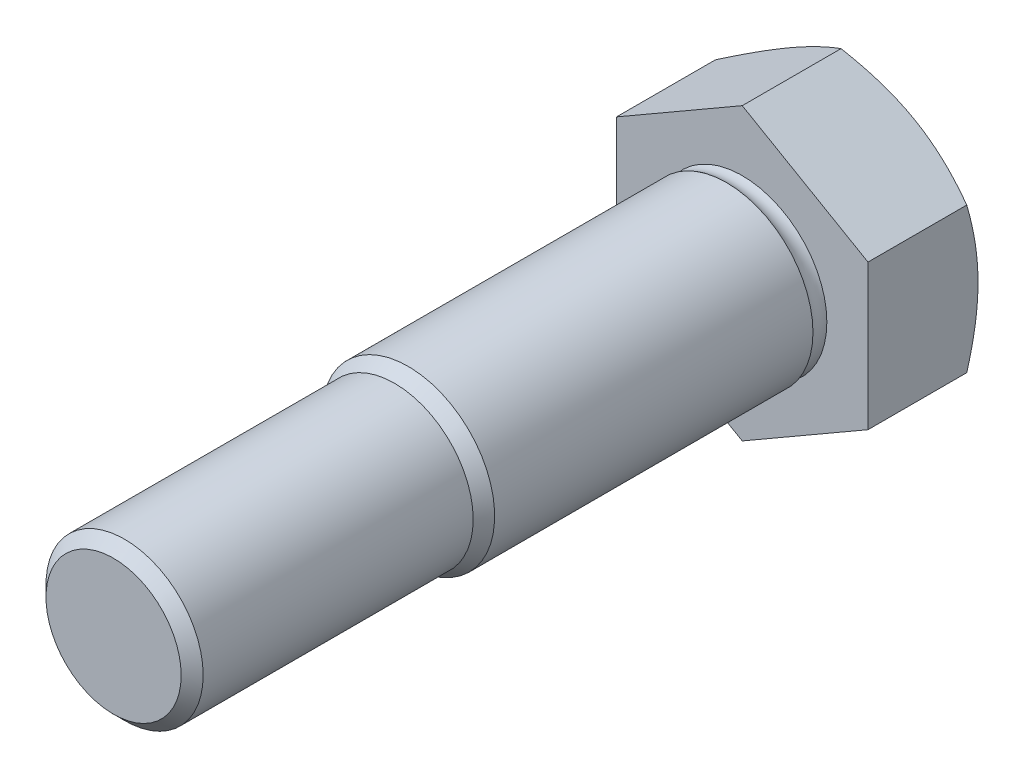
from build123d import *

# Parameters (mm, degrees)
VYSUNOUT1_DEPTH = 7
SKICA5_R        = 5
VYSUNOUT4_DEPTH = 40
ZKOSIT1_SIZE    = 0.7
SKICA3_R        = 5.3
VYSUNOUT2_DEPTH = 1
SKICA4_R        = 5.5
VYSUNOUT3_DEPTH = 21.12


with BuildPart() as part:
    # Skica1 → Vysunout1 (new body)
    with BuildSketch(Plane.XY):
        Polygon((8, -4.618802154), (8, 4.618802154), (0, 9.237604307), (-8, 4.618802154), (-8, -4.618802154), (0, -9.237604307), align=None)
    extrude(amount=VYSUNOUT1_DEPTH)

    # Skica2 → Odebrat otočením1 (revolve, cut)
    with BuildSketch(Plane(origin=(0, 0, 0), x_dir=(1, 0, 0), z_dir=(0, 1, 0))):
        Polygon((8, 0), (20.124355653, 0), (20.124355653, -7), align=None)
    revolve(axis=Axis((0, 0, 0), (0, 0, 1)), mode=Mode.SUBTRACT)

    # Skica5 → Vysunout4 (add)
    with BuildSketch(Plane.XY.offset(7)):
        Circle(SKICA5_R)
    extrude(amount=VYSUNOUT4_DEPTH)

    # Zkosit1
    zkosit1_edges = [part.edges().sort_by_distance(p)[0] for p in [
        (-5, 0, 47),
    ]]
    chamfer(zkosit1_edges, length=ZKOSIT1_SIZE)

    # Skica3 → Vysunout2 (add)
    with BuildSketch(Plane.XY.offset(7)):
        Circle(SKICA3_R)
    extrude(amount=VYSUNOUT2_DEPTH)

    # Skica4 → Vysunout3 (add)
    with BuildSketch(Plane.XY.offset(8)):
        with Locations(Location((0, 0, 0), (0, 0, 180))):
            Circle(SKICA4_R)
    extrude(amount=VYSUNOUT3_DEPTH)

    # Skica6 → Odebrat otočením2 (revolve, cut)
    with BuildSketch(Plane(origin=(0, 0, 0), x_dir=(1, 0, 0), z_dir=(0, 1, 0))):
        Polygon((-5.5, -29.12), (-5.5, -28.253974596), (-5, -29.12), align=None)
    revolve(axis=Axis((0, 0, 29.12), (0, 0, -1)), mode=Mode.SUBTRACT)

    # Skica7 → Otočit kolem osy1 (revolve)
    with BuildSketch(Plane(origin=(0, 0, 0), x_dir=(1, 0, 0), z_dir=(0, 1, 0))):
        with BuildLine():
            ThreePointArc((5.3, -7.4), (5.321093687, -7.195690356), (5.383484861, -7))
            Line((5.383484861, -7), (5.3, -7))
            Line((5.3, -7), (5.3, -7.4))
        make_face()
        with BuildLine():
            ThreePointArc((5.5, -8), (5.351316702, -7.716227766), (5.3, -7.4))
            Line((5.3, -7.4), (5.3, -8))
            Line((5.3, -8), (5.5, -8))
        make_face()
    revolve(axis=Axis((0, 0, 28.253974596), (0, 0, -1)))


solid = part.part
